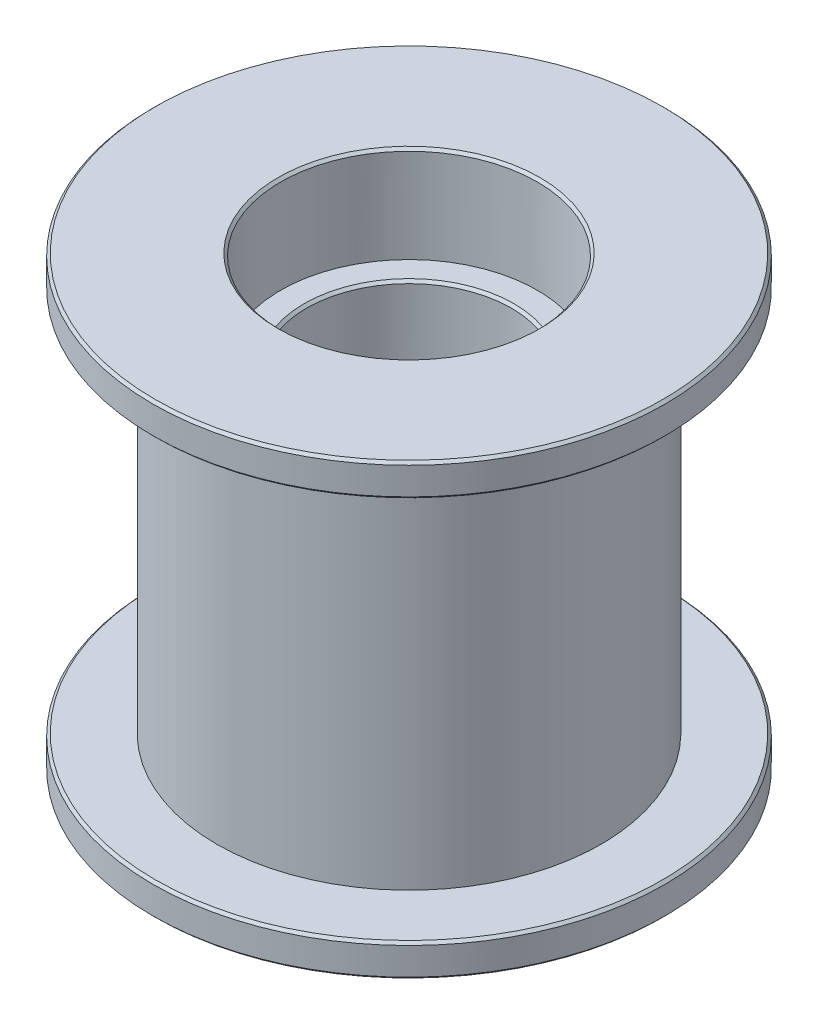
from build123d import *

# Parameters (mm, degrees)
CHAMFER1_SIZE = 0.127


with BuildPart() as part:
    # Sketch1 → Revolve1 (revolve)
    with BuildSketch(Plane.XY, mode=Mode.PRIVATE) as revolve1_sk:
        Polygon((6.3627, 0), (12.7, 0), (12.7, 1.61249995), (9.525, 1.61249995), (9.525, 20.61250005), (12.7, 20.61250005), (12.7, 22.225), (6.3627, 22.225), (6.3627, 17.4498), (5.08, 17.4498), (5.08, 4.7752), (6.3627, 4.7752), align=None)
    revolve(revolve1_sk.sketch.rotate(Axis((0, 22.225, 0), (0, -1, 0)), 90), axis=Axis((0, 22.225, 0), (0, -1, 0)))

    # Chamfer1
    chamfer1_edges = [part.edges().sort_by_distance(p)[0] for p in [
        (0, 4.7752, -5.08),
        (0, 17.4498, -5.08),
        (0, 22.225, -6.3627),
        (0, 22.225, -12.7),
        (0, 20.61250005, -12.7),
        (0, 1.61249995, -12.7),
        (0, 0, -12.7),
        (0, 0, -6.3627),
    ]]
    chamfer(chamfer1_edges, length=CHAMFER1_SIZE)


solid = part.part
